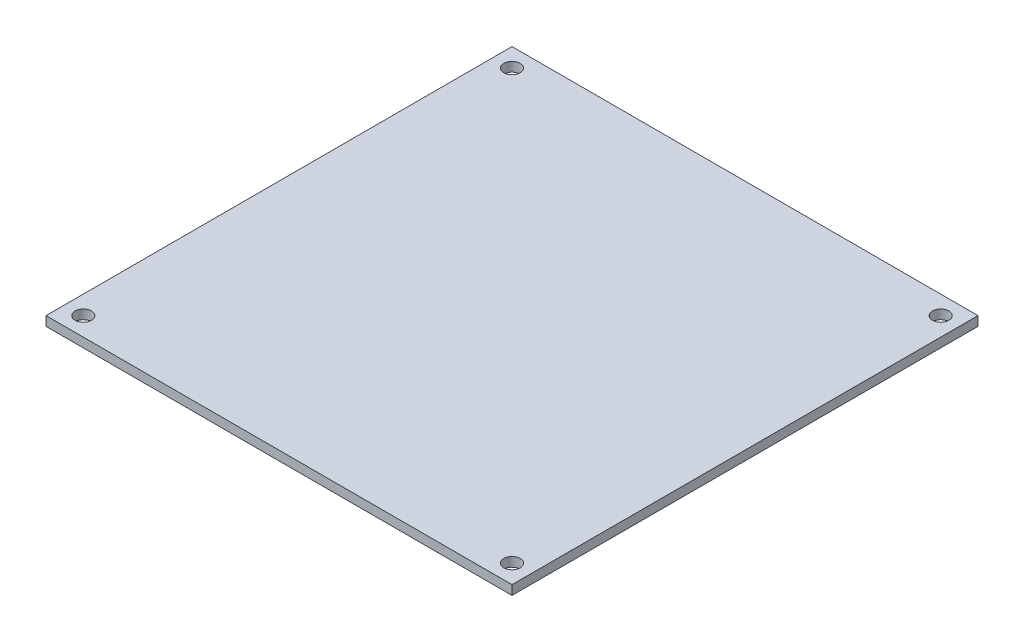
from build123d import *

# Parameters (mm, degrees)
SKETCH_2_W      = 100
SKETCH_2_H      = 100
SKETCH_2_R      = 1.75
EXTRUDE_1_DEPTH = 2


with BuildPart() as part:
    # 스케치2 → 보스-돌출1 (new body)
    with BuildSketch(Plane(origin=(0, 0, 0), x_dir=(1, 0, 0), z_dir=(0, 1, 0))):
        Rectangle(SKETCH_2_W, SKETCH_2_H)
        with Locations(Location((-46, 46, 0), (0, 0, 270))):
            Circle(SKETCH_2_R, mode=Mode.SUBTRACT)
        with Locations(Location((46, 46, 0), (0, 0, 90))):
            Circle(SKETCH_2_R, mode=Mode.SUBTRACT)
        with Locations(Location((46, -46, 0), (0, 0, 270))):
            Circle(SKETCH_2_R, mode=Mode.SUBTRACT)
        with Locations(Location((-46, -46, 0), (0, 0, 90))):
            Circle(SKETCH_2_R, mode=Mode.SUBTRACT)
    extrude(amount=EXTRUDE_1_DEPTH)


solid = part.part
